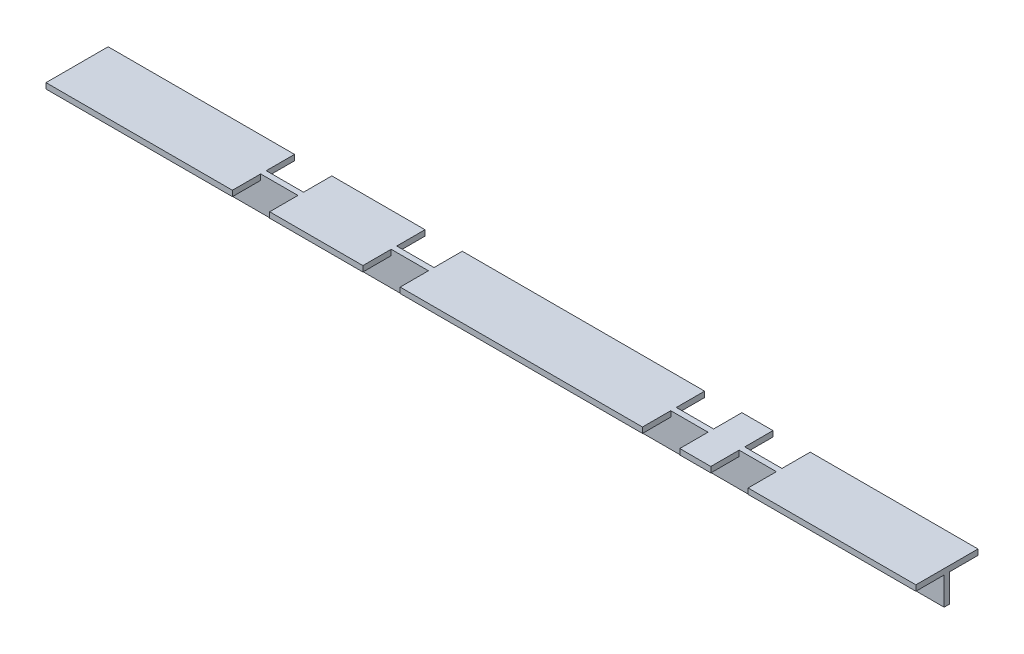
from build123d import *

# Parameters (mm, degrees)
BOSS_EXTRUDE1_DEPTH = 1400
SKETCH1_W           = 60
SKETCH1_H           = 45.5
CUT_EXTRUDE1_DEPTH  = 1405.288075859


with BuildPart() as part:
    # Sketch T → Boss-Extrude1 (new body)
    with BuildSketch(Plane(origin=(0, 0, 0), x_dir=(0, 0, -1), z_dir=(1, 0, 0))):
        Polygon((0, 0), (100, 0), (100, -9), (54.5, -9), (54.5, -54), (45.5, -54), (45.5, -9), (0, -9), align=None)
    extrude(amount=BOSS_EXTRUDE1_DEPTH)

    # Sketch1 → Cut-Extrude1 (cut, through all)
    with BuildSketch(Plane(origin=(0, -9, 0), x_dir=(-1, 0, 0), z_dir=(0, -1, 0))):
        with Locations((-330, 22.75)):
            Rectangle(SKETCH1_W, SKETCH1_H)
        with Locations((-540, 22.75)):
            Rectangle(SKETCH1_W, SKETCH1_H)
        with Locations((-1100, 22.75)):
            Rectangle(SKETCH1_W, SKETCH1_H)
        with Locations((-1100, 77.25)):
            Rectangle(SKETCH1_W, SKETCH1_H)
        with Locations((-540, 77.25)):
            Rectangle(SKETCH1_W, SKETCH1_H)
        with Locations((-330, 77.25)):
            Rectangle(SKETCH1_W, SKETCH1_H)
        with Locations((-990, 22.75)):
            Rectangle(SKETCH1_W, SKETCH1_H)
        with Locations((-990, 77.25)):
            Rectangle(SKETCH1_W, SKETCH1_H)
    extrude(amount=-CUT_EXTRUDE1_DEPTH, mode=Mode.SUBTRACT)


solid = part.part
